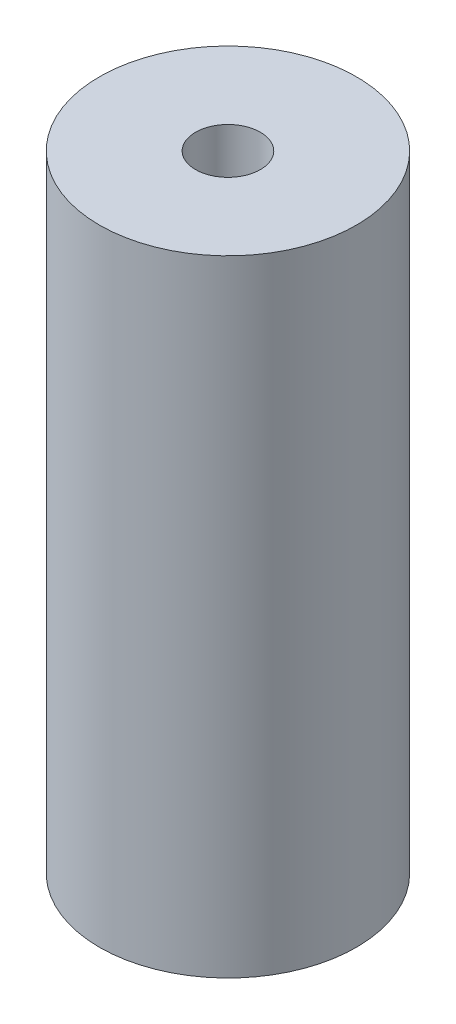
from build123d import *

# Parameters (mm, degrees)
SKETCH1_R           = 11.3
BOSS_EXTRUDE1_DEPTH = 55
SKETCH2_R           = 2.85
CUT_EXTRUDE1_DEPTH  = 110


with BuildPart() as part:
    # Sketch1 → Boss-Extrude1 (new body)
    with BuildSketch(Plane(origin=(0, 0, 0), x_dir=(1, 0, 0), z_dir=(0, 1, 0))):
        with Locations(Location((0, 0, 0), (0, 0, 270))):
            Circle(SKETCH1_R)
    extrude(amount=BOSS_EXTRUDE1_DEPTH)

    # Sketch2 → Cut-Extrude1 (cut)
    with BuildSketch(Plane(origin=(0, 55, 0), x_dir=(1, 0, 0), z_dir=(0, 1, 0))):
        with Locations(Location((0, 0, 0), (0, 0, 270))):
            Circle(SKETCH2_R)
    extrude(amount=-CUT_EXTRUDE1_DEPTH, mode=Mode.SUBTRACT)


solid = part.part
